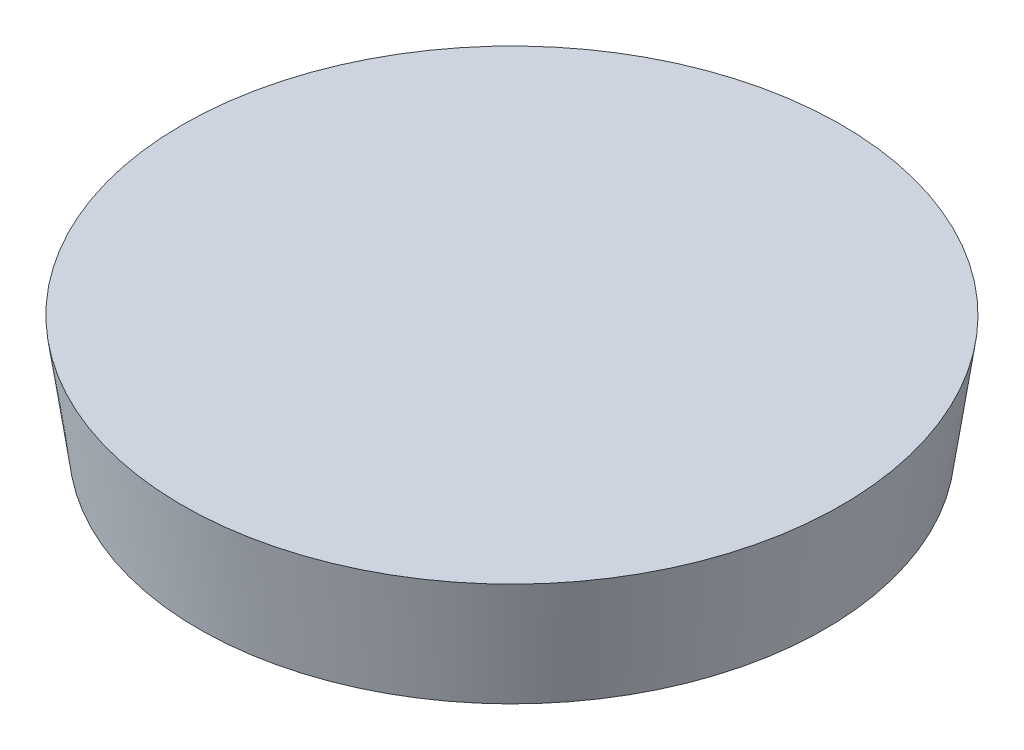
from build123d import *

# Parameters (mm, degrees)
SKETCH3_R           = 4
BOSS_EXTRUDE1_DEPTH = 1.2


with BuildPart() as part:
    # Sketch2 → Revolve1 (revolve)
    with BuildSketch(Plane.XY, mode=Mode.PRIVATE) as revolve1_sk:
        Polygon((0, 0), (9.5, 0), (10, 3.5), (0, 3.5), align=None)
    revolve(revolve1_sk.sketch.rotate(Axis((0, 3.5, 0), (0, -1, 0)), 180), axis=Axis((0, 3.5, 0), (0, -1, 0)))

    # Sketch3 → Boss-Extrude1 (add)
    with BuildSketch(Plane.XZ):
        Circle(SKETCH3_R)
    extrude(amount=BOSS_EXTRUDE1_DEPTH)


solid = part.part
